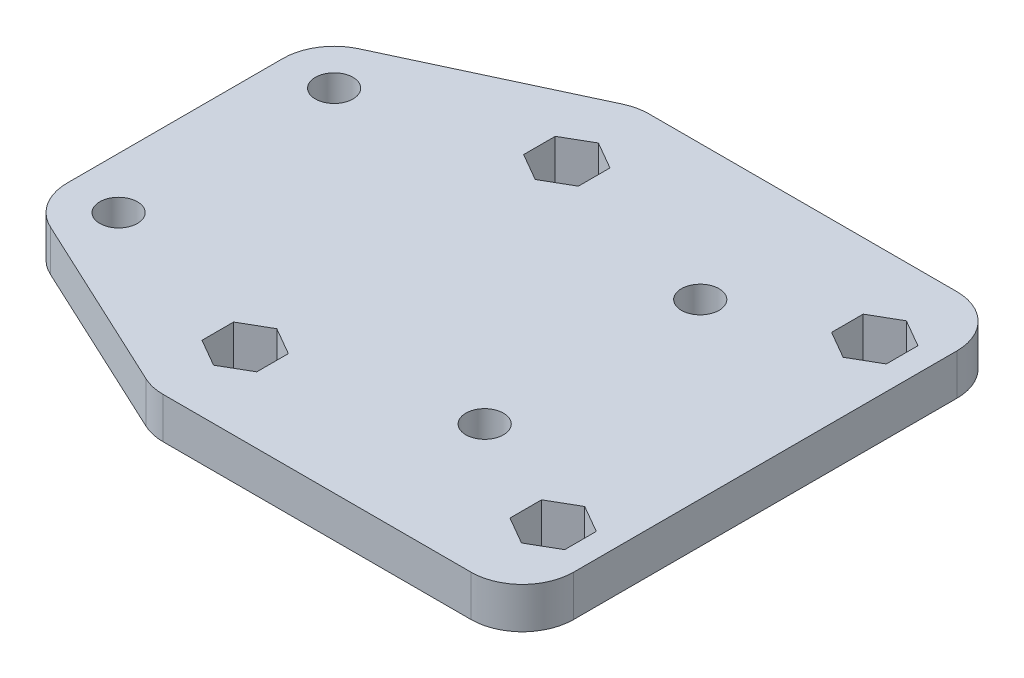
from build123d import *

# Parameters (mm, degrees)
SKETCH1_R               = 7.5
SKETCH1_R_2             = 2.75
SKETCH1_R_3             = 2.5
BOSS_EXTRUDE1_DEPTH     = 6
CUT_EXTRUDE1_DEPTH      = 70.758959998
CUT_EXTRUDE1_DEPTH_BACK = 70.758959998


with BuildPart() as part:
    # Sketch1 → Boss-Extrude1 (new body)
    # profile 1 of 7: a face of its own
    with BuildSketch(Plane(origin=(0, 0, 0), x_dir=(1, 0, 0), z_dir=(0, 1, 0))):
        with Locations((-52.25, 15.75)):
            Circle(SKETCH1_R)
        with Locations(Location((-52.25, 15.75, 0), (0, 0, 270))):
            Circle(SKETCH1_R_2, mode=Mode.SUBTRACT)
    # profile 2 of 7: a face of its own
    with BuildSketch(Plane(origin=(0, 0, 0), x_dir=(1, 0, 0), z_dir=(0, 1, 0))):
        with BuildLine():
            ThreePointArc((-44.75, 15.75), (-52.25, 8.25), (-59.75, 15.75))
            Line((-59.75, 15.75), (-59.75, -15.75))
            ThreePointArc((-59.75, -15.75), (-52.25, -8.25), (-44.75, -15.75))
            ThreePointArc((-44.75, -15.75), (-48.221185498, -22.076029854), (-55.42164099, -22.54637355))
            Line((-55.42164099, -22.54637355), (-29.17164099, -34.79637355))
            ThreePointArc((-29.17164099, -34.79637355), (-30.028814502, -21.673970146), (-18.5, -28))
            ThreePointArc((-18.5, -28), (-20.696699141, -33.303300859), (-26, -35.5))
            Line((-26, -35.5), (19, -35.5))
            ThreePointArc((19, -35.5), (13.696699141, -22.696699141), (26.5, -28))
            Line((26.5, -28), (26.5, 28))
            ThreePointArc((26.5, 28), (13.696699141, 22.696699141), (19, 35.5))
            Line((19, 35.5), (-26, 35.5))
            ThreePointArc((-26, 35.5), (-20.696699141, 33.303300859), (-18.5, 28))
            ThreePointArc((-18.5, 28), (-30.028814502, 21.673970146), (-29.17164099, 34.79637355))
            Line((-29.17164099, 34.79637355), (-55.42164099, 22.54637355))
            ThreePointArc((-55.42164099, 22.54637355), (-48.221185498, 22.076029854), (-44.75, 15.75))
        make_face()
        with Locations(Location((1.25, -15.75, 0), (0, 0, 270))):
            Circle(SKETCH1_R_2, mode=Mode.SUBTRACT)
        with Locations(Location((1.25, 15.75, 0), (0, 0, 270))):
            Circle(SKETCH1_R_2, mode=Mode.SUBTRACT)
    # profile 3 of 7: a face of its own
    with BuildSketch(Plane(origin=(0, 0, 0), x_dir=(1, 0, 0), z_dir=(0, 1, 0))):
        with Locations((-52.25, -15.75)):
            Circle(SKETCH1_R)
        with Locations(Location((-52.25, -15.75, 0), (0, 0, 270))):
            Circle(SKETCH1_R_2, mode=Mode.SUBTRACT)
    # profile 4 of 7: a face of its own
    with BuildSketch(Plane(origin=(0, 0, 0), x_dir=(1, 0, 0), z_dir=(0, 1, 0))):
        with Locations((-26, -28)):
            Circle(SKETCH1_R)
        with Locations(Location((-26, -23.5, 0), (0, 0, 270))):
            Circle(SKETCH1_R_3, mode=Mode.SUBTRACT)
    # profile 5 of 7: a face of its own
    with BuildSketch(Plane(origin=(0, 0, 0), x_dir=(1, 0, 0), z_dir=(0, 1, 0))):
        with Locations((19, -28)):
            Circle(SKETCH1_R)
        with Locations(Location((19, -23.5, 0), (0, 0, 270))):
            Circle(SKETCH1_R_3, mode=Mode.SUBTRACT)
    # profile 6 of 7: a face of its own
    with BuildSketch(Plane(origin=(0, 0, 0), x_dir=(1, 0, 0), z_dir=(0, 1, 0))):
        with Locations((19, 28)):
            Circle(SKETCH1_R)
        with Locations(Location((19, 23.5, 0), (0, 0, 270))):
            Circle(SKETCH1_R_3, mode=Mode.SUBTRACT)
    # profile 7 of 7: a face of its own
    with BuildSketch(Plane(origin=(0, 0, 0), x_dir=(1, 0, 0), z_dir=(0, 1, 0))):
        with Locations((-26, 28)):
            Circle(SKETCH1_R)
        with Locations(Location((-26, 23.5, 0), (0, 0, 270))):
            Circle(SKETCH1_R_3, mode=Mode.SUBTRACT)
    extrude(amount=BOSS_EXTRUDE1_DEPTH)

    # Sketch2 → Cut-Extrude1 (cut, two sides: drawn at the far end of the back side and taken through both)
    with BuildSketch(Plane(origin=(0, 6, 0), x_dir=(1, 0, 0), z_dir=(0, 1, 0)).offset(-CUT_EXTRUDE1_DEPTH_BACK)):
        Polygon((-26, 18.881197846), (-22, 21.190598923), (-22, 25.809401077), (-26, 28.118802154), (-30, 25.809401077), (-30, 21.190598923), align=None)
        Polygon((-26, -18.881197846), (-30, -21.190598923), (-30, -25.809401077), (-26, -28.118802154), (-22, -25.809401077), (-22, -21.190598923), align=None)
        Polygon((15, -25.809401077), (19, -28.118802154), (23, -25.809401077), (23, -21.190598923), (19, -18.881197846), (15, -21.190598923), align=None)
        Polygon((19, 18.881197846), (23, 21.190598923), (23, 25.809401077), (19, 28.118802154), (15, 25.809401077), (15, 21.190598923), align=None)
    extrude(amount=CUT_EXTRUDE1_DEPTH + CUT_EXTRUDE1_DEPTH_BACK, mode=Mode.SUBTRACT)


solid = part.part
